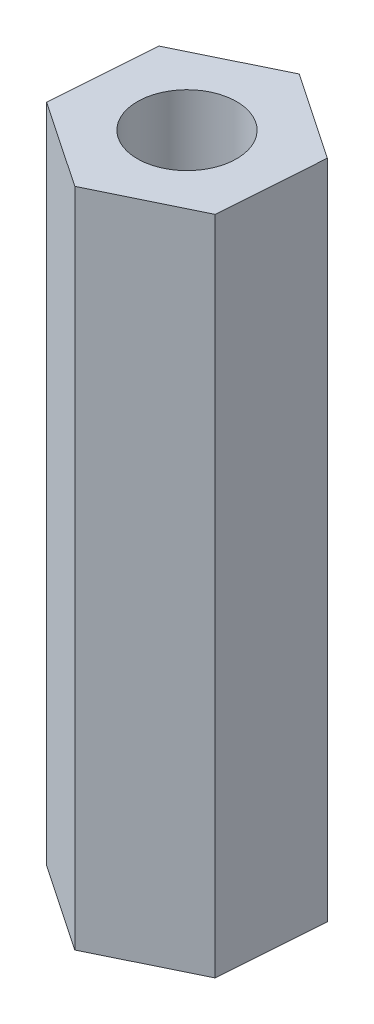
from build123d import *

# Parameters (mm, degrees)
SKETCH1_R           = 1.5
BOSS_EXTRUDE1_DEPTH = 20


with BuildPart() as part:
    # Sketch1 → Boss-Extrude1 (new body)
    with BuildSketch(Plane(origin=(0, 0, 0), x_dir=(1, 0, 0), z_dir=(0, 1, 0))):
        Polygon((2.630154555, -1.779219028), (2.855926154, 1.388171147), (0.225771599, 3.167390175), (-2.630154555, 1.779219028), (-2.855926154, -1.388171147), (-0.225771599, -3.167390175), align=None)
        with Locations(Location((0, 0, 0), (0, 0, 270))):
            Circle(SKETCH1_R, mode=Mode.SUBTRACT)
    extrude(amount=BOSS_EXTRUDE1_DEPTH)


solid = part.part
